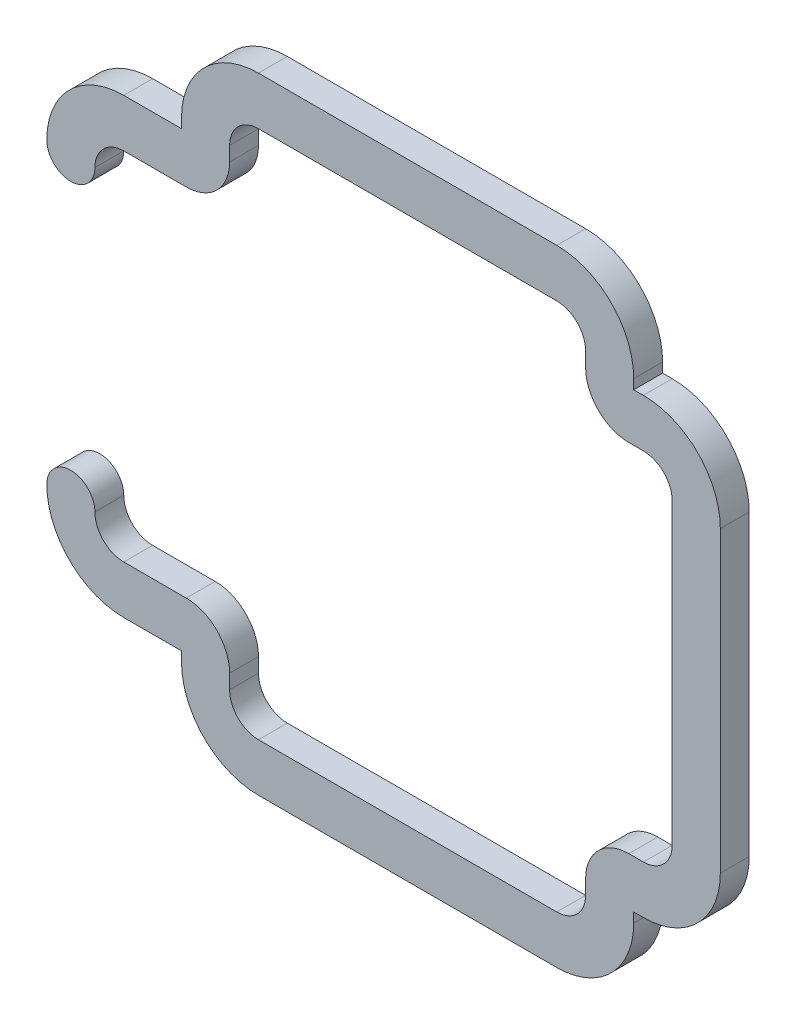
from build123d import *

# Parameters (mm, degrees)
RESSALTO_EXTRUS_O1_DEPTH = 3


with BuildPart() as part:
    # Esboço1 → Ressalto-extrusão1 (new body)
    with BuildSketch(Plane.XY):
        with BuildLine():
            Line((-38.5, -4.5), (-7.5, -4.5))
            ThreePointArc((-7.5, -4.5), (-5.378679656, -3.621320344), (-4.5, -1.5))
            Line((-4.5, -1.5), (-4.5, 0))
            ThreePointArc((-4.5, 0), (-3.181980515, 3.181980515), (0, 4.5))
            Line((0, 4.5), (1.5, 4.5))
            ThreePointArc((1.5, 4.5), (3.621320344, 5.378679656), (4.5, 7.5))
            Line((4.5, 7.5), (4.5, 38.5))
            ThreePointArc((4.5, 38.5), (3.621320344, 40.621320344), (1.5, 41.5))
            Line((1.5, 41.5), (0, 41.5))
            ThreePointArc((0, 41.5), (-3.181980515, 42.818019485), (-4.5, 46))
            Line((-4.5, 46), (-4.5, 47.5))
            ThreePointArc((-4.5, 47.5), (-5.378679656, 49.621320344), (-7.5, 50.5))
            Line((-7.5, 50.5), (-38.5, 50.5))
            ThreePointArc((-38.5, 50.5), (-40.621320344, 49.621320344), (-41.5, 47.5))
            Line((-41.5, 47.5), (-41.5, 46))
            ThreePointArc((-41.5, 46), (-42.818019485, 42.818019485), (-46, 41.5))
            Line((-46, 41.5), (-52.5, 41.5))
            ThreePointArc((-52.5, 41.5), (-54.621320344, 40.621320344), (-55.5, 38.5))
            ThreePointArc((-55.5, 38.5), (-58, 36), (-60.5, 38.5))
            ThreePointArc((-60.5, 38.5), (-58.156854249, 44.156854249), (-52.5, 46.5))
            Line((-52.5, 46.5), (-46.5, 46.5))
            Line((-46.5, 46.5), (-46.5, 47.5))
            ThreePointArc((-46.5, 47.5), (-44.156854249, 53.156854249), (-38.5, 55.5))
            Line((-38.5, 55.5), (-7.5, 55.5))
            ThreePointArc((-7.5, 55.5), (-1.843145751, 53.156854249), (0.5, 47.5))
            Line((0.5, 47.5), (0.5, 46.5))
            Line((0.5, 46.5), (1.5, 46.5))
            ThreePointArc((1.5, 46.5), (7.156854249, 44.156854249), (9.5, 38.5))
            Line((9.5, 38.5), (9.5, 7.5))
            ThreePointArc((9.5, 7.5), (7.156854249, 1.843145751), (1.5, -0.5))
            Line((1.5, -0.5), (0.5, -0.5))
            Line((0.5, -0.5), (0.5, -1.5))
            ThreePointArc((0.5, -1.5), (-1.843145751, -7.156854249), (-7.5, -9.5))
            Line((-7.5, -9.5), (-38.5, -9.5))
            ThreePointArc((-38.5, -9.5), (-44.156854249, -7.156854249), (-46.5, -1.5))
            Line((-46.5, -1.5), (-46.5, -0.5))
            Line((-46.5, -0.5), (-52.5, -0.5))
            ThreePointArc((-52.5, -0.5), (-58.156854249, 1.843145751), (-60.5, 7.5))
            ThreePointArc((-60.5, 7.5), (-58, 10), (-55.5, 7.5))
            ThreePointArc((-55.5, 7.5), (-54.621320344, 5.378679656), (-52.5, 4.5))
            Line((-52.5, 4.5), (-46, 4.5))
            ThreePointArc((-46, 4.5), (-42.818019485, 3.181980515), (-41.5, 0))
            Line((-41.5, 0), (-41.5, -1.5))
            ThreePointArc((-41.5, -1.5), (-40.621320344, -3.621320344), (-38.5, -4.5))
        make_face()
    extrude(amount=RESSALTO_EXTRUS_O1_DEPTH)


solid = part.part
